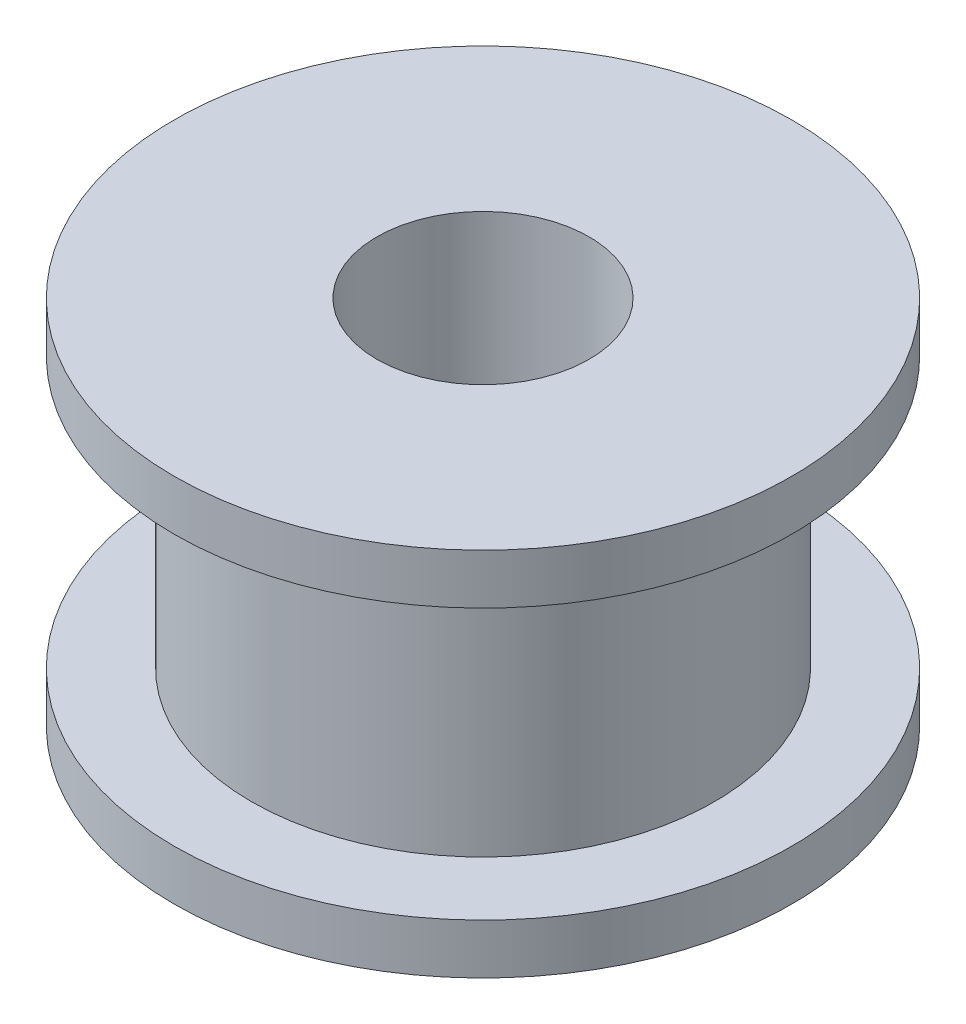
from build123d import *

# Parameters (mm, degrees)
SKETCH1_R           = 8
BOSS_EXTRUDE1_DEPTH = 1.3
SKETCH2_R           = 6
BOSS_EXTRUDE2_DEPTH = 7
SKETCH3_R           = 8
BOSS_EXTRUDE3_DEPTH = 1.3
SKETCH4_R           = 2.75
CUT_EXTRUDE1_DEPTH  = 8.6


with BuildPart() as part:
    # Sketch1 → Boss-Extrude1 (new body)
    with BuildSketch(Plane(origin=(0, 0, 0), x_dir=(1, 0, 0), z_dir=(0, 1, 0))):
        with Locations(Location((0, 0, 0), (0, 0, 270))):
            Circle(SKETCH1_R)
    extrude(amount=BOSS_EXTRUDE1_DEPTH)

    # Sketch2 → Boss-Extrude2 (add)
    with BuildSketch(Plane(origin=(0, 1.3, 0), x_dir=(1, 0, 0), z_dir=(0, 1, 0))):
        with Locations(Location((0, 0, 0), (0, 0, 270))):
            Circle(SKETCH2_R)
    extrude(amount=BOSS_EXTRUDE2_DEPTH)

    # Sketch3 → Boss-Extrude3 (add)
    with BuildSketch(Plane(origin=(0, 8.3, 0), x_dir=(1, 0, 0), z_dir=(0, 1, 0))):
        with Locations(Location((0, 0, 0), (0, 0, 270))):
            Circle(SKETCH3_R)
    extrude(amount=BOSS_EXTRUDE3_DEPTH)

    # Sketch4 → Cut-Extrude1 (cut)
    with BuildSketch(Plane(origin=(0, 9.6, 0), x_dir=(1, 0, 0), z_dir=(0, 1, 0))):
        with Locations(Location((0, 0, 0), (0, 0, 270))):
            Circle(SKETCH4_R)
    extrude(amount=-CUT_EXTRUDE1_DEPTH, mode=Mode.SUBTRACT)


solid = part.part
